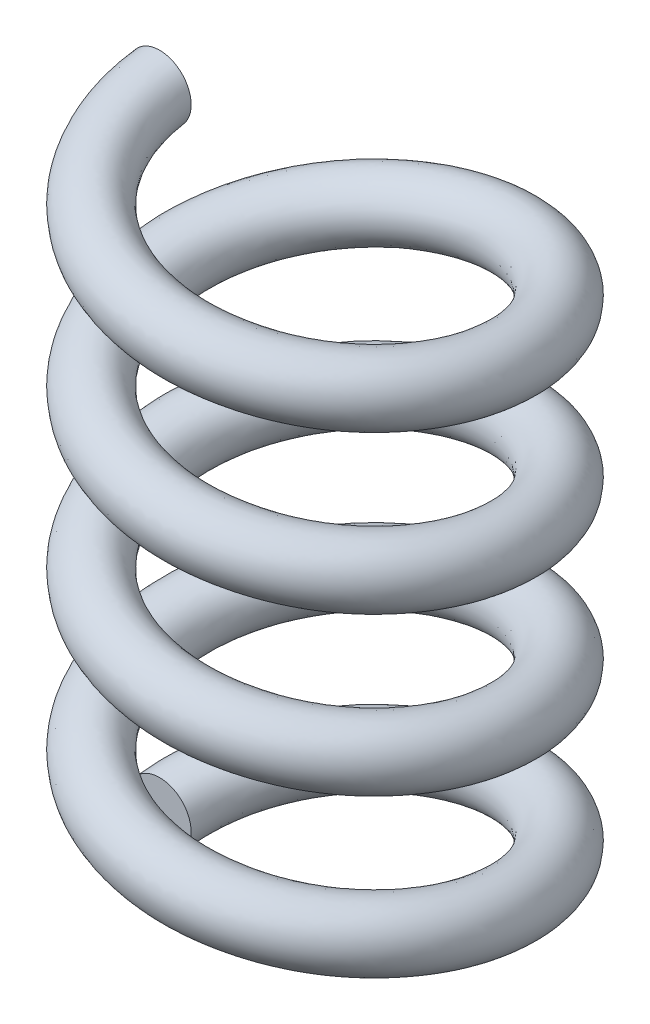
from build123d import *

# Parameters (mm, degrees)
SWEEP_1_PITCH       = 2
SWEEP_1_HEIGHT      = 8
SWEEP_1_RADIUS      = 2.75
SWEEP_1_START_ANGLE = -90
SKETCH_2_R          = 0.4


with BuildPart() as part:
    # 扫描1: sweep along a helix
    with BuildLine() as sweep_1_path:
        add(Helix(SWEEP_1_PITCH, SWEEP_1_HEIGHT, SWEEP_1_RADIUS, center=(0, 0, 0), direction=(0, 1, 0), lefthand=True, mode=Mode.PRIVATE).rotate(Axis((0, 0, 0), (0, 1, 0)), SWEEP_1_START_ANGLE))
    # 草图2 → 扫描1 (sweep)
    with BuildSketch(Plane.XY):
        with Locations((-2.1, 7.364285095)):
            Circle(SKETCH_2_R)
    sweep(path=sweep_1_path.line, is_frenet=True)


solid = part.part
